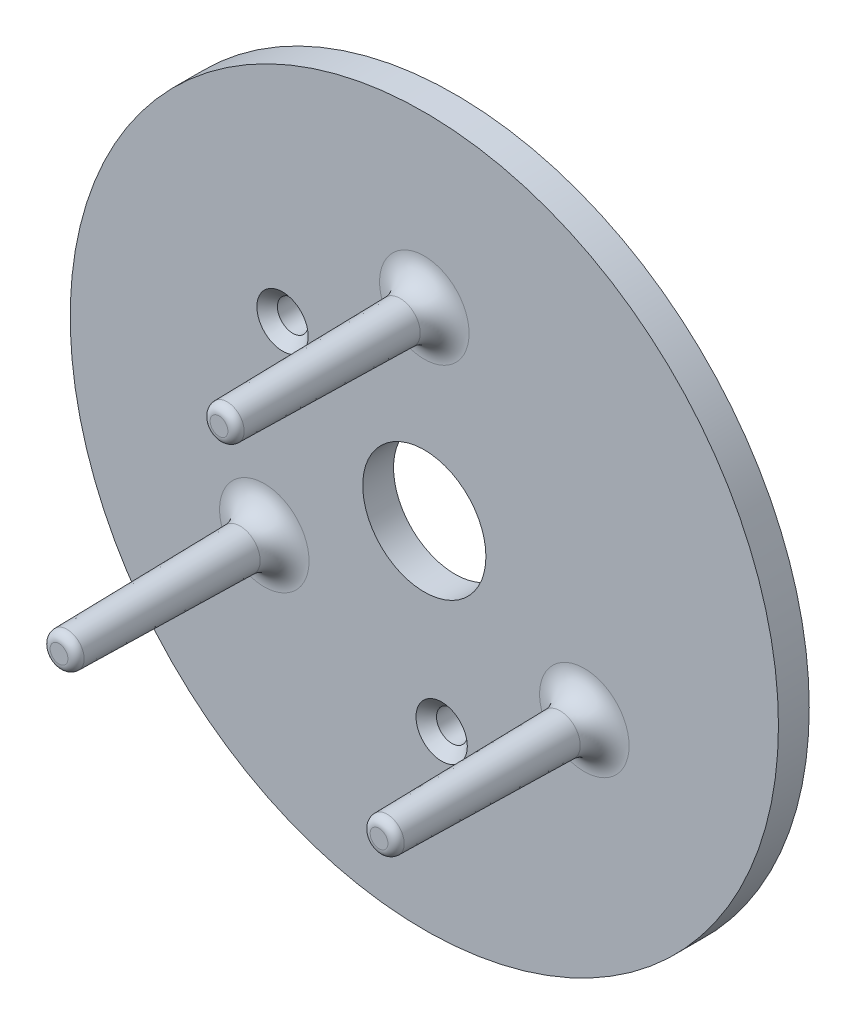
from build123d import *

# Parameters (mm, degrees)
SKETCH3_R                = 34.5
SKETCH3_R_2              = 2
SKETCH3_R_3              = 6
BOSS_EXTRUDE1_DEPTH      = 3
BOSS_EXTRUDE2_START      = 3
SKETCH3_3_R              = 2
BOSS_EXTRUDE2_DEPTH      = 20
BOSS_EXTRUDE2_TAPER      = 1
FILLET2_R                = 0.8
FILLET3_R                = 2.4
CIRPATTERN1_COUNT        = 3
FILLET2_OF_CIRPATTERN1_R = 0.8
FILLET3_OF_CIRPATTERN1_R = 2.4
CUT_EXTRUDE1_REACH       = 54.73
SKETCH4_R                = 1.5
CHAMFER1_SIZE            = 1


with BuildPart() as part:
    # Sketch3 → Boss-Extrude1 (new body)
    # profile 1 of 2: a face of its own
    with BuildSketch(Plane(origin=(0, 0, 0), x_dir=(0, 1, 0), z_dir=(0, 0, 1))):
        with Locations(Location((0, 0, 0), (0, 0, 270))):
            Circle(SKETCH3_R)
        with Locations((18, 0)):
            Circle(SKETCH3_R_2, mode=Mode.SUBTRACT)
        with Locations(Location((0, 0, 0), (0, 0, 270))):
            Circle(SKETCH3_R_3, mode=Mode.SUBTRACT)
    # profile 2 of 2: a face of its own
    with BuildSketch(Plane(origin=(0, 0, 0), x_dir=(0, 1, 0), z_dir=(0, 0, 1))):
        with Locations((18, 0)):
            Circle(SKETCH3_R_2)
    extrude(amount=BOSS_EXTRUDE1_DEPTH)

    # Sketch3<3> → Boss-Extrude2 (add)
    with BuildSketch(Plane(origin=(0, 0, 0), x_dir=(0, 1, 0), z_dir=(0, 0, 1)).offset(BOSS_EXTRUDE2_START)):
        with Locations((18, 0)):
            Circle(SKETCH3_3_R)
    boss_extrude2 = extrude(amount=BOSS_EXTRUDE2_DEPTH, taper=BOSS_EXTRUDE2_TAPER)

    # Fillet2
    fillet2_edges = [part.edges().sort_by_distance(p)[0] for p in [
        (0, 16.349101299, 23),
    ]]
    fillet(fillet2_edges, radius=FILLET2_R)

    # Fillet3
    fillet3_edges = [part.edges().sort_by_distance(p)[0] for p in [
        (0, 16, 3),
    ]]
    fillet(fillet3_edges, radius=FILLET3_R)

    # CirPattern1: Boss-Extrude2 ×3 about axis
    cirpattern1_axis = Axis((0, 0, 0), (0, 0, 1))
    for i in range(1, CIRPATTERN1_COUNT):
        add(boss_extrude2.rotate(cirpattern1_axis, i * 360 / CIRPATTERN1_COUNT))

    # Fillet2 of CirPattern1
    fillet2_of_cirpattern1_edges = [part.edges().sort_by_distance(p)[0] for p in [
        (-14.158737054, -8.174550649, 23),
        (14.158737054, -8.174550649, 23),
    ]]
    fillet(fillet2_of_cirpattern1_edges, radius=FILLET2_OF_CIRPATTERN1_R)

    # Fillet3 of CirPattern1
    fillet3_of_cirpattern1_edges = [part.edges().sort_by_distance(p)[0] for p in [
        (-13.856406461, -8, 3),
        (13.856406461, -8, 3),
    ]]
    fillet(fillet3_of_cirpattern1_edges, radius=FILLET3_OF_CIRPATTERN1_R)

    # Sketch4 → Cut-Extrude1 (cut, up to next)
    with BuildSketch(Plane.XY.offset(3), mode=Mode.PRIVATE) as cut_extrude1_sk1:
        with Locations((1.687822174, -16.923393759)):
            Circle(SKETCH4_R)
    cut_extrude1_tool1 = extrude(cut_extrude1_sk1.sketch, amount=-CUT_EXTRUDE1_REACH, mode=Mode.PRIVATE) & part.part
    # Sketch4 → Cut-Extrude1 (cut, up to next)
    with BuildSketch(Plane.XY.offset(3), mode=Mode.PRIVATE) as cut_extrude1_sk2:
        with Locations((-13.812177826, 9.923393759)):
            Circle(SKETCH4_R)
    cut_extrude1_tool2 = extrude(cut_extrude1_sk2.sketch, amount=-CUT_EXTRUDE1_REACH, mode=Mode.PRIVATE) & part.part
    add(cut_extrude1_tool1.solids().sort_by_distance((1.687822, -16.923394, 3))[0], mode=Mode.SUBTRACT)
    add(cut_extrude1_tool2.solids().sort_by_distance((-13.812178, 9.923394, 3))[0], mode=Mode.SUBTRACT)

    # Chamfer1
    chamfer1_edges = [part.edges().sort_by_distance(p)[0] for p in [
        (0.187822174, -16.923393759, 3),
        (-15.312177826, 9.923393759, 3),
    ]]
    chamfer(chamfer1_edges, length=CHAMFER1_SIZE)


solid = part.part
